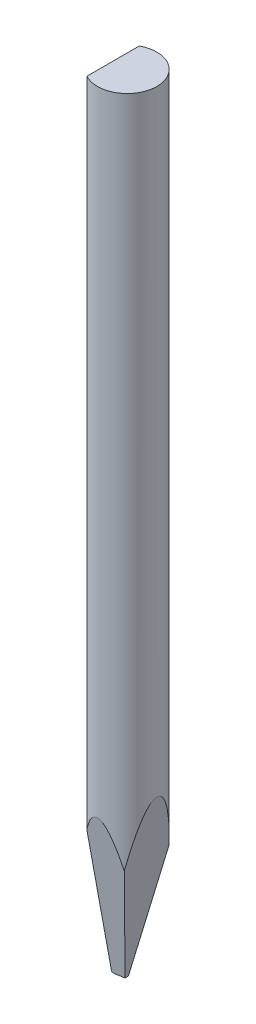
from build123d import *

# Parameters (mm, degrees)
TD_SKETCH_R                   = 0.792499939
TL_FEATURE_DEPTH              = 20.99999991
TDF_STD_SKETCH_W              = 1.604999838
TDF_STD_SKETCH_H              = 1.604999838
TDF_STD_FEATURE_DEPTH         = 22.02988608
ISA_20_STD_FEATURE_DEPTH      = 22.02988608
ISA_20_STD_FEATURE_DEPTH_BACK = 22.02988608
F_10BA_STD_FEATURE_DEPTH      = 22.02988608
F_10BA_STD_FEATURE_DEPTH_BACK = 22.02988608
FRO_STD_FEATURE_DEPTH         = 22.02988608
FRO_STD_FEATURE_DEPTH_BACK    = 22.02988608


with BuildPart() as part:
    # TD_sketch → TL_feature (new body)
    with BuildSketch(Plane(origin=(0, 0, 0), x_dir=(1, 0, 0), z_dir=(0, 1, 0))):
        Circle(TD_SKETCH_R)
    extrude(amount=TL_FEATURE_DEPTH)

    # TDF_STD_sketch → TDF_STD_feature (cut, through all)
    with BuildSketch(Plane(origin=(0, 0, 0), x_dir=(1, 0, 0), z_dir=(0, 1, 0))):
        with Locations((-1.17799993, 0)):
            Rectangle(TDF_STD_SKETCH_W, TDF_STD_SKETCH_H)
    extrude(amount=TDF_STD_FEATURE_DEPTH, mode=Mode.SUBTRACT)

    # ISA_20_STD_sketch → ISA_20_STD_feature (cut, two sides: drawn at the far end of the back side and taken through both)
    with BuildSketch(Plane(origin=(0, 0, 0), x_dir=(0, 0, -1), z_dir=(1, 0, 0)).offset(-ISA_20_STD_FEATURE_DEPTH_BACK)):
        Polygon((-13.462346915, 73.159859471), (-3.889221277, 20.99999991), (-0.035000057, 0), (0.035000057, 0), (3.889221277, 20.99999991), (13.462346915, 73.159859471), (13.462346915, -32.902305016), (-13.462346915, -32.902305016), align=None)
    extrude(amount=ISA_20_STD_FEATURE_DEPTH + ISA_20_STD_FEATURE_DEPTH_BACK, mode=Mode.SUBTRACT)

    # 10BA_STD_sketch → 10BA_STD_feature (cut, two sides: drawn at the far end of the back side and taken through both)
    with BuildSketch(Plane.XY.offset(-F_10BA_STD_FEATURE_DEPTH_BACK)):
        Polygon((-53.152802148, 0), (-0.375500011, 0), (-0.289499929, 0), (-0.010835963, 0.049135976), (3.683366618, 20.99999991), (12.848048956, 72.975496238), (91.13369141, 2.172017021), (25.132840305, -70.803479216), align=None)
    extrude(amount=F_10BA_STD_FEATURE_DEPTH + F_10BA_STD_FEATURE_DEPTH_BACK, mode=Mode.SUBTRACT)

    # FRO_STD_sketch → FRO_STD_feature (cut, two sides: drawn at the far end of the back side and taken through both)
    with BuildSketch(Plane.XY.offset(-FRO_STD_FEATURE_DEPTH_BACK)):
        with BuildLine():
            Line((-0.375601611, 52.089797523), (-0.375601611, 0.02794))
            ThreePointArc((-0.375601611, 0.02794), (-0.367418174, 0.008183437), (-0.347661611, 0))
            Line((-0.347661611, 0), (51.714195912, 0))
            Line((51.714195912, 0), (-21.91238908, -73.626584992))
            Line((-21.91238908, -73.626584992), (-74.002186603, -21.536787469))
            Line((-74.002186603, -21.536787469), (-0.375601611, 52.089797523))
        make_face()
    extrude(amount=FRO_STD_FEATURE_DEPTH + FRO_STD_FEATURE_DEPTH_BACK, mode=Mode.SUBTRACT)


solid = part.part
